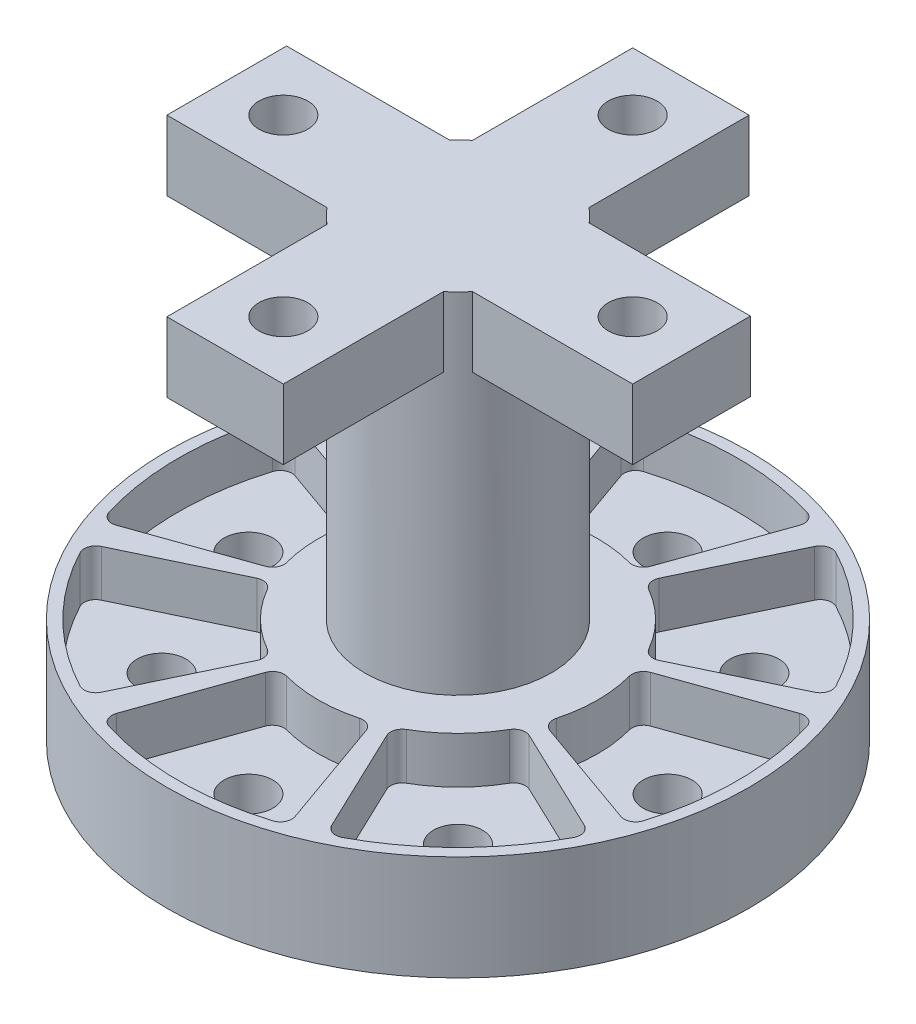
from build123d import *

# Parameters (mm, degrees)
SKETCH_1_R      = 25
SKETCH_1_R_2    = 2.1
EXTRUDE_1_DEPTH = 5
SKETCH_2_R      = 25
SKETCH_2_R_2    = 24
SKETCH_2_R_3    = 12
EXTRUDE_2_DEPTH = 4
FILLET_1_R      = 1
SKETCH_3_R      = 8
EXTRUDE_3_DEPTH = 30
SKETCH_4_R      = 2.1
EXTRUDE_5_DEPTH = 6


with BuildPart() as part:
    # Эскиз1 → Бобышка-Вытянуть1 (new body)
    with BuildSketch(Plane(origin=(0, 0, 0), x_dir=(1, 0, 0), z_dir=(0, 1, 0))):
        with Locations(Location((0, 0, 0), (0, 0, 270))):
            Circle(SKETCH_1_R)
        with Locations(Location((-18, 0, 0), (0, 0, 270))):
            Circle(SKETCH_1_R_2, mode=Mode.SUBTRACT)
        with Locations(Location((-12.727922061, 12.727922061, 0), (0, 0, 270))):
            Circle(SKETCH_1_R_2, mode=Mode.SUBTRACT)
        with Locations(Location((0, 18, 0), (0, 0, 270))):
            Circle(SKETCH_1_R_2, mode=Mode.SUBTRACT)
        with Locations(Location((12.727922061, 12.727922061, 0), (0, 0, 270))):
            Circle(SKETCH_1_R_2, mode=Mode.SUBTRACT)
        with Locations(Location((18, 0, 0), (0, 0, 270))):
            Circle(SKETCH_1_R_2, mode=Mode.SUBTRACT)
        with Locations(Location((12.727922061, -12.727922061, 0), (0, 0, 270))):
            Circle(SKETCH_1_R_2, mode=Mode.SUBTRACT)
        with Locations(Location((0, -18, 0), (0, 0, 270))):
            Circle(SKETCH_1_R_2, mode=Mode.SUBTRACT)
        with Locations(Location((-12.727922061, -12.727922061, 0), (0, 0, 270))):
            Circle(SKETCH_1_R_2, mode=Mode.SUBTRACT)
    extrude(amount=EXTRUDE_1_DEPTH)

    # Эскиз2 → Бобышка-Вытянуть2 (add)
    # profile 1 of 10: a face of its own
    with BuildSketch(Plane(origin=(0, 5, 0), x_dir=(1, 0, 0), z_dir=(0, 1, 0))):
        with Locations(Location((0, 0, 0), (0, 0, 270))):
            Circle(SKETCH_2_R)
        Circle(SKETCH_2_R_2, mode=Mode.SUBTRACT)
    # profile 2 of 10: a face of its own
    with BuildSketch(Plane(origin=(0, 5, 0), x_dir=(1, 0, 0), z_dir=(0, 1, 0))):
        Circle(SKETCH_2_R_3)
    # profile 3 of 10: a face of its own
    with BuildSketch(Plane(origin=(0, 5, 0), x_dir=(1, 0, 0), z_dir=(0, 1, 0))):
        with BuildLine():
            Line((-10.332266323, 21.662046824), (-5.166133162, 10.831023412))
            ThreePointArc((-5.166133162, 10.831023412), (-4.592201188, 11.08655439), (-4.005682311, 11.311697893))
            Line((-4.005682311, 11.311697893), (-8.011364622, 22.623395786))
            ThreePointArc((-8.011364622, 22.623395786), (-9.184402377, 22.17310878), (-10.332266323, 21.662046824))
        make_face()
    # profile 4 of 10: a face of its own
    with BuildSketch(Plane(origin=(0, 5, 0), x_dir=(1, 0, 0), z_dir=(0, 1, 0))):
        with BuildLine():
            Line((8.011364622, 22.623395786), (4.005682311, 11.311697893))
            ThreePointArc((4.005682311, 11.311697893), (4.592201188, 11.08655439), (5.166133162, 10.831023412))
            Line((5.166133162, 10.831023412), (10.332266323, 21.662046824))
            ThreePointArc((10.332266323, 21.662046824), (9.184402377, 22.17310878), (8.011364622, 22.623395786))
        make_face()
    # profile 5 of 10: a face of its own
    with BuildSketch(Plane(origin=(0, 5, 0), x_dir=(1, 0, 0), z_dir=(0, 1, 0))):
        with BuildLine():
            ThreePointArc((10.831023412, 5.166133162), (11.08655439, 4.592201188), (11.311697893, 4.005682311))
            Line((11.311697893, 4.005682311), (22.623395786, 8.011364622))
            ThreePointArc((22.623395786, 8.011364622), (22.17310878, 9.184402377), (21.662046824, 10.332266323))
            Line((21.662046824, 10.332266323), (10.831023412, 5.166133162))
        make_face()
    # profile 6 of 10: a face of its own
    with BuildSketch(Plane(origin=(0, 5, 0), x_dir=(1, 0, 0), z_dir=(0, 1, 0))):
        with BuildLine():
            ThreePointArc((11.311697893, -4.005682311), (11.08655439, -4.592201188), (10.831023412, -5.166133162))
            Line((10.831023412, -5.166133162), (21.662046824, -10.332266323))
            ThreePointArc((21.662046824, -10.332266323), (22.17310878, -9.184402377), (22.623395786, -8.011364622))
            Line((22.623395786, -8.011364622), (11.311697893, -4.005682311))
        make_face()
    # profile 7 of 10: a face of its own
    with BuildSketch(Plane(origin=(0, 5, 0), x_dir=(1, 0, 0), z_dir=(0, 1, 0))):
        with BuildLine():
            ThreePointArc((5.166133162, -10.831023412), (4.592201188, -11.08655439), (4.005682311, -11.311697893))
            Line((4.005682311, -11.311697893), (8.011364622, -22.623395786))
            ThreePointArc((8.011364622, -22.623395786), (9.184402377, -22.17310878), (10.332266323, -21.662046824))
            Line((10.332266323, -21.662046824), (5.166133162, -10.831023412))
        make_face()
    # profile 8 of 10: a face of its own
    with BuildSketch(Plane(origin=(0, 5, 0), x_dir=(1, 0, 0), z_dir=(0, 1, 0))):
        with BuildLine():
            ThreePointArc((-4.005682311, -11.311697893), (-4.592201188, -11.08655439), (-5.166133162, -10.831023412))
            Line((-5.166133162, -10.831023412), (-10.332266323, -21.662046824))
            ThreePointArc((-10.332266323, -21.662046824), (-9.184402377, -22.17310878), (-8.011364622, -22.623395786))
            Line((-8.011364622, -22.623395786), (-4.005682311, -11.311697893))
        make_face()
    # profile 9 of 10: a face of its own
    with BuildSketch(Plane(origin=(0, 5, 0), x_dir=(1, 0, 0), z_dir=(0, 1, 0))):
        with BuildLine():
            Line((-21.662046824, -10.332266323), (-10.831023412, -5.166133162))
            ThreePointArc((-10.831023412, -5.166133162), (-11.08655439, -4.592201188), (-11.311697893, -4.005682311))
            Line((-11.311697893, -4.005682311), (-22.623395786, -8.011364622))
            ThreePointArc((-22.623395786, -8.011364622), (-22.17310878, -9.184402377), (-21.662046824, -10.332266323))
        make_face()
    # profile 10 of 10: a face of its own
    with BuildSketch(Plane(origin=(0, 5, 0), x_dir=(1, 0, 0), z_dir=(0, 1, 0))):
        with BuildLine():
            Line((-22.623395786, 8.011364622), (-11.311697893, 4.005682311))
            ThreePointArc((-11.311697893, 4.005682311), (-11.08655439, 4.592201188), (-10.831023412, 5.166133162))
            Line((-10.831023412, 5.166133162), (-21.662046824, 10.332266323))
            ThreePointArc((-21.662046824, 10.332266323), (-22.17310878, 9.184402377), (-22.623395786, 8.011364622))
        make_face()
    extrude(amount=EXTRUDE_2_DEPTH)

    # Скругление1
    fillet_1_edges = [part.edges().sort_by_distance(p)[0] for p in [
        (5.166133162, 7, 10.831023412),
        (10.831023412, 7, 5.166133162),
        (21.662046824, 7, 10.332266323),
        (22.623395786, 7, 8.011364622),
        (11.311697893, 7, 4.005682311),
        (11.311697893, 7, -4.005682311),
        (21.662046824, 7, -10.332266323),
        (10.831023412, 7, -5.166133162),
        (5.166133162, 7, -10.831023412),
        (8.011364622, 7, -22.623395786),
        (4.005682311, 7, -11.311697893),
        (-4.005682311, 7, -11.311697893),
        (-10.332266323, 7, -21.662046824),
        (-5.166133162, 7, -10.831023412),
        (-10.831023412, 7, -5.166133162),
        (-22.623395786, 7, -8.011364622),
        (-11.311697893, 7, -4.005682311),
        (-11.311697893, 7, 4.005682311),
        (-21.662046824, 7, 10.332266323),
        (-10.831023412, 7, 5.166133162),
        (-5.166133162, 7, 10.831023412),
        (-8.011364622, 7, 22.623395786),
        (-4.005682311, 7, 11.311697893),
        (4.005682311, 7, 11.311697893),
        (10.332266323, 7, 21.662046824),
        (22.623395786, 7, -8.011364622),
        (10.332266323, 7, -21.662046824),
        (-8.011364622, 7, -22.623395786),
        (-21.662046824, 7, -10.332266323),
        (-22.623395786, 7, 8.011364622),
        (-10.332266323, 7, 21.662046824),
        (8.011364622, 7, 22.623395786),
    ]]
    fillet(fillet_1_edges, radius=FILLET_1_R)

    # Эскиз3 → Бобышка-Вытянуть3 (add)
    with BuildSketch(Plane(origin=(0, 9, 0), x_dir=(1, 0, 0), z_dir=(0, 1, 0))):
        with Locations(Location((0, 0, 0), (0, 0, 270))):
            Circle(SKETCH_3_R)
    extrude(amount=EXTRUDE_3_DEPTH)

    # Эскиз4 → Бобышка-Вытянуть5 (add)
    with BuildSketch(Plane(origin=(0, 39, 0), x_dir=(1, 0, 0), z_dir=(0, 1, 0))):
        Polygon((5, -20), (5, -5), (20, -5), (20, 5.110143601), (5, 5.110143601), (5, 20), (-5, 20), (-5, 5.280605092), (-20, 5.280605092), (-20, -5), (-5, -5), (-5, -20), align=None)
        with Locations(Location((15, 0, 0), (0, 0, 270))):
            Circle(SKETCH_4_R, mode=Mode.SUBTRACT)
        with Locations(Location((0, 15, 0), (0, 0, 270))):
            Circle(SKETCH_4_R, mode=Mode.SUBTRACT)
        with Locations(Location((-15, 0, 0), (0, 0, 270))):
            Circle(SKETCH_4_R, mode=Mode.SUBTRACT)
        with Locations(Location((0, -15, 0), (0, 0, 270))):
            Circle(SKETCH_4_R, mode=Mode.SUBTRACT)
    extrude(amount=-EXTRUDE_5_DEPTH)


solid = part.part
